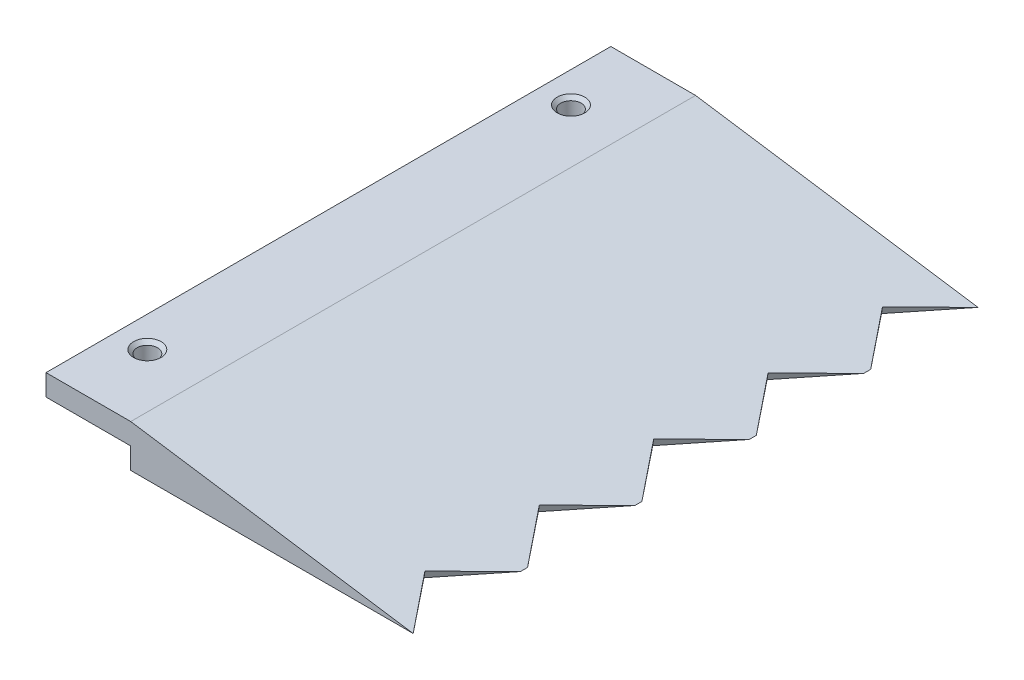
from build123d import *

# Parameters (mm, degrees)
BOSS_EXTRUDE1_DEPTH = 40
CUT_EXTRUDE1_DEPTH  = 40
SKETCH4_R           = 1.45
CUT_EXTRUDE2_DEPTH  = 40
CHAMFER1_SIZE       = 0.5


with BuildPart() as part:
    # Sketch1 → Boss-Extrude1 (new, symmetric)
    with BuildSketch(Plane.XY):
        Polygon((0, 6), (12, 6), (52, 0), (12, 0), (12, 3), (0, 3), align=None)
    extrude(amount=BOSS_EXTRUDE1_DEPTH, both=True)

    # Sketch3 → Cut-Extrude1 (cut, symmetric)
    with BuildSketch(Plane(origin=(1.144254279, 7.628361858, 0), x_dir=(0.9889363528682976, -0.14834045293024462, 0), z_dir=(0.14834045293024462, 0.9889363528682976, 0))):
        Polygon((51.424690349, -40), (45.424690349, -32.4), (51.424690349, -24.8), align=None)
        Polygon((51.424690349, -23.8), (51.424690349, -8.6), (45.424690349, -16.2), align=None)
        Polygon((51.424690349, -7.6), (51.424690349, 7.6), (45.424690349, 0), align=None)
        Polygon((51.424690349, 8.6), (51.424690349, 23.8), (45.424690349, 16.2), align=None)
        Polygon((51.424690349, 24.8), (51.424690349, 40), (45.424690349, 32.4), align=None)
    extrude(amount=CUT_EXTRUDE1_DEPTH, both=True, mode=Mode.SUBTRACT)

    # Sketch4 → Cut-Extrude2 (cut, symmetric)
    with BuildSketch(Plane(origin=(0, 6, 0), x_dir=(1, 0, 0), z_dir=(0, 1, 0))):
        with Locations(Location((4.35, -30, 0), (0, 0, 180))):
            Circle(SKETCH4_R)
        with Locations(Location((4.35, 30, 0), (0, 0, 180))):
            Circle(SKETCH4_R)
    extrude(amount=CUT_EXTRUDE2_DEPTH, both=True, mode=Mode.SUBTRACT)

    # Chamfer1
    chamfer1_edges = [part.edges().sort_by_distance(p)[0] for p in [
        (5.8, 6, 30),
        (5.8, 6, -30),
    ]]
    chamfer(chamfer1_edges, length=CHAMFER1_SIZE)


solid = part.part
